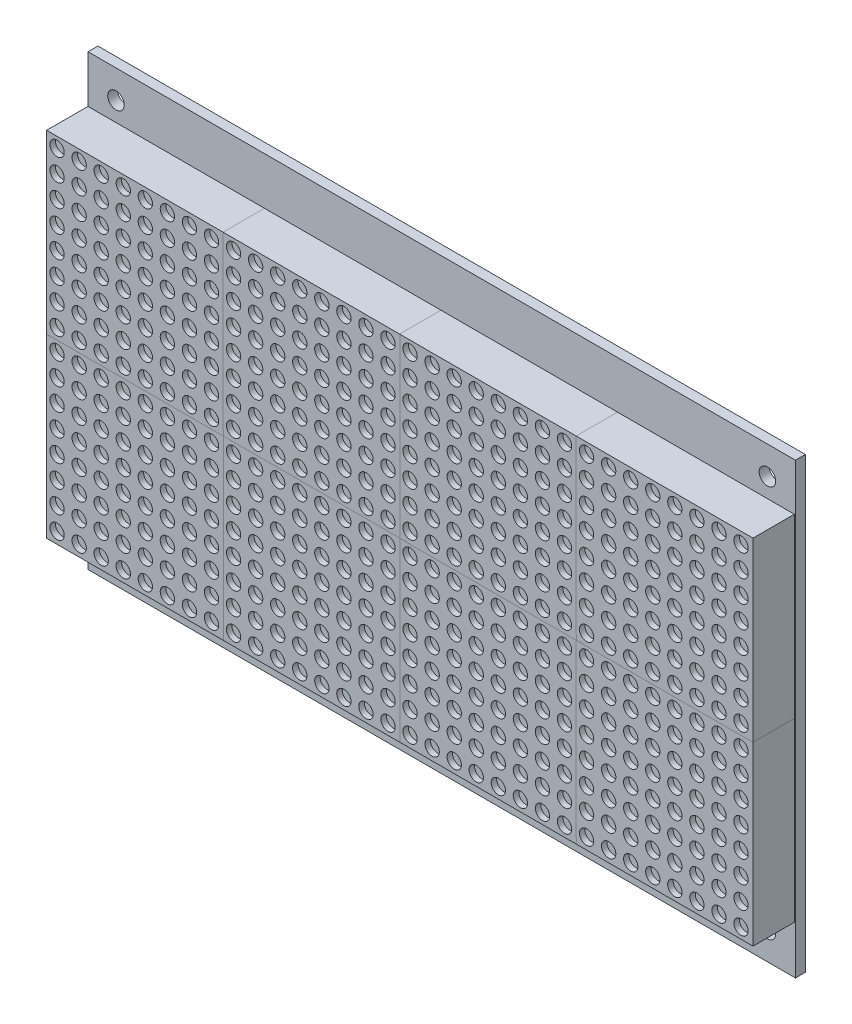
from build123d import *

# Parameters (mm, degrees)
SKETCH1_W           = 128.27
SKETCH1_H           = 81.3
SKETCH1_R           = 1.5
BOSS_EXTRUDE1_DEPTH = 1.8
SKETCH2_W           = 32.0675
SKETCH2_H           = 32.0675
BOSS_EXTRUDE2_DEPTH = 7.5
SKETCH3_R           = 1.3
CUT_EXTRUDE1_DEPTH  = 1
LPATTERN2_COUNT     = 4
LPATTERN2_PITCH     = 32
LPATTERN2_2_COUNT   = 2
LPATTERN2_2_PITCH   = 32
SKETCH4_W           = 30
SKETCH4_H           = 8.6
BOSS_EXTRUDE3_DEPTH = 17


with BuildPart() as part:
    # Sketch1 → Boss-Extrude1 (new body)
    with BuildSketch(Plane.XY):
        with Locations((64.135, 40.65)):
            Rectangle(SKETCH1_W, SKETCH1_H)
        with Locations((5.08, 76.2)):
            Circle(SKETCH1_R, mode=Mode.SUBTRACT)
        with Locations(Location((123.19, 76.2, 0), (0, 0, 180))):
            Circle(SKETCH1_R, mode=Mode.SUBTRACT)
        with Locations((123.19, 5.1)):
            Circle(SKETCH1_R, mode=Mode.SUBTRACT)
        with Locations(Location((5.08, 5.1, 0), (0, 0, 180))):
            Circle(SKETCH1_R, mode=Mode.SUBTRACT)
    extrude(amount=BOSS_EXTRUDE1_DEPTH)

    # Sketch4 → Boss-Extrude3 (add)
    with BuildSketch(Plane(origin=(0, 0, 0), x_dir=(-1, 0, 0), z_dir=(0, 0, -1))):
        with Locations((-27, 26.7)):
            Rectangle(SKETCH4_W, SKETCH4_H)
    extrude(amount=BOSS_EXTRUDE3_DEPTH)


with BuildPart() as body_2:
    # Sketch2 → Boss-Extrude2 (new body)
    with BuildSketch(Plane.XY.offset(1.8)):
        with Locations((16.03375, 56.68375)):
            Rectangle(SKETCH2_W, SKETCH2_H)
    extrude(amount=BOSS_EXTRUDE2_DEPTH)

    # Sketch3 → Cut-Extrude1 (cut)
    with BuildSketch(Plane.XY.offset(9.3)):
        with Locations((1.9, 70.8175)):
            Circle(SKETCH3_R)
        with Locations((5.9, 70.8)):
            Circle(SKETCH3_R)
        with Locations((9.9, 70.7825)):
            Circle(SKETCH3_R)
        with Locations((13.9, 70.765)):
            Circle(SKETCH3_R)
        with Locations((17.9, 70.7475)):
            Circle(SKETCH3_R)
        with Locations((21.9, 70.73)):
            Circle(SKETCH3_R)
        with Locations((25.9, 70.7125)):
            Circle(SKETCH3_R)
        with Locations((29.9, 70.695)):
            Circle(SKETCH3_R)
        with Locations((1.9, 66.8)):
            Circle(SKETCH3_R)
        with Locations((5.9, 66.7825)):
            Circle(SKETCH3_R)
        with Locations((9.9, 66.765)):
            Circle(SKETCH3_R)
        with Locations((13.9, 66.7475)):
            Circle(SKETCH3_R)
        with Locations((17.9, 66.73)):
            Circle(SKETCH3_R)
        with Locations((21.9, 66.7125)):
            Circle(SKETCH3_R)
        with Locations((25.9, 66.695)):
            Circle(SKETCH3_R)
        with Locations((29.9, 66.6775)):
            Circle(SKETCH3_R)
        with Locations((1.9, 62.7825)):
            Circle(SKETCH3_R)
        with Locations((5.9, 62.765)):
            Circle(SKETCH3_R)
        with Locations((9.9, 62.7475)):
            Circle(SKETCH3_R)
        with Locations((13.9, 62.73)):
            Circle(SKETCH3_R)
        with Locations((17.9, 62.7125)):
            Circle(SKETCH3_R)
        with Locations((21.9, 62.695)):
            Circle(SKETCH3_R)
        with Locations((25.9, 62.6775)):
            Circle(SKETCH3_R)
        with Locations((29.9, 62.66)):
            Circle(SKETCH3_R)
        with Locations((1.9, 58.765)):
            Circle(SKETCH3_R)
        with Locations((5.9, 58.7475)):
            Circle(SKETCH3_R)
        with Locations((9.9, 58.73)):
            Circle(SKETCH3_R)
        with Locations((13.9, 58.7125)):
            Circle(SKETCH3_R)
        with Locations((17.9, 58.695)):
            Circle(SKETCH3_R)
        with Locations((21.9, 58.6775)):
            Circle(SKETCH3_R)
        with Locations((25.9, 58.66)):
            Circle(SKETCH3_R)
        with Locations((29.9, 58.6425)):
            Circle(SKETCH3_R)
        with Locations((1.9, 54.7475)):
            Circle(SKETCH3_R)
        with Locations((5.9, 54.73)):
            Circle(SKETCH3_R)
        with Locations((9.9, 54.7125)):
            Circle(SKETCH3_R)
        with Locations((13.9, 54.695)):
            Circle(SKETCH3_R)
        with Locations((17.9, 54.6775)):
            Circle(SKETCH3_R)
        with Locations((21.9, 54.66)):
            Circle(SKETCH3_R)
        with Locations((25.9, 54.6425)):
            Circle(SKETCH3_R)
        with Locations((29.9, 54.625)):
            Circle(SKETCH3_R)
        with Locations((1.9, 50.73)):
            Circle(SKETCH3_R)
        with Locations((5.9, 50.7125)):
            Circle(SKETCH3_R)
        with Locations((9.9, 50.695)):
            Circle(SKETCH3_R)
        with Locations((13.9, 50.6775)):
            Circle(SKETCH3_R)
        with Locations((17.9, 50.66)):
            Circle(SKETCH3_R)
        with Locations((21.9, 50.6425)):
            Circle(SKETCH3_R)
        with Locations((25.9, 50.625)):
            Circle(SKETCH3_R)
        with Locations((29.9, 50.6075)):
            Circle(SKETCH3_R)
        with Locations((1.9, 46.7125)):
            Circle(SKETCH3_R)
        with Locations((5.9, 46.695)):
            Circle(SKETCH3_R)
        with Locations((9.9, 46.6775)):
            Circle(SKETCH3_R)
        with Locations((13.9, 46.66)):
            Circle(SKETCH3_R)
        with Locations((17.9, 46.6425)):
            Circle(SKETCH3_R)
        with Locations((21.9, 46.625)):
            Circle(SKETCH3_R)
        with Locations((25.9, 46.6075)):
            Circle(SKETCH3_R)
        with Locations((29.9, 46.59)):
            Circle(SKETCH3_R)
        with Locations((1.9, 42.695)):
            Circle(SKETCH3_R)
        with Locations((5.9, 42.6775)):
            Circle(SKETCH3_R)
        with Locations((9.9, 42.66)):
            Circle(SKETCH3_R)
        with Locations((13.9, 42.6425)):
            Circle(SKETCH3_R)
        with Locations((17.9, 42.625)):
            Circle(SKETCH3_R)
        with Locations((21.9, 42.6075)):
            Circle(SKETCH3_R)
        with Locations((25.9, 42.59)):
            Circle(SKETCH3_R)
        with Locations((29.9, 42.5725)):
            Circle(SKETCH3_R)
    extrude(amount=-CUT_EXTRUDE1_DEPTH, mode=Mode.SUBTRACT)


with BuildPart() as lpattern2_1:
    # LPattern2: pattern copy
    add(body_2.part.moved(Location(Vector(1, 0, 0) * (1 * LPATTERN2_PITCH))))


with BuildPart() as lpattern2_2:
    # LPattern2: pattern copy
    add(body_2.part.moved(Location(Vector(1, 0, 0) * (2 * LPATTERN2_PITCH))))


with BuildPart() as lpattern2_3:
    # LPattern2: pattern copy
    add(body_2.part.moved(Location(Vector(1, 0, 0) * (3 * LPATTERN2_PITCH))))


with BuildPart() as lpattern2_2_1:
    # LPattern2 2: pattern copy
    add(body_2.part.moved(Location(Vector(0, -1, 0) * (1 * LPATTERN2_2_PITCH))))


with BuildPart() as lpattern2_2_2:
    # LPattern2 2: pattern copy
    add(lpattern2_1.part.moved(Location(Vector(0, -1, 0) * (1 * LPATTERN2_2_PITCH))))


with BuildPart() as lpattern2_2_3:
    # LPattern2 2: pattern copy
    add(lpattern2_2.part.moved(Location(Vector(0, -1, 0) * (1 * LPATTERN2_2_PITCH))))


with BuildPart() as lpattern2_2_4:
    # LPattern2 2: pattern copy
    add(lpattern2_3.part.moved(Location(Vector(0, -1, 0) * (1 * LPATTERN2_2_PITCH))))


solid = Compound([part.part, body_2.part, lpattern2_1.part, lpattern2_2.part, lpattern2_3.part, lpattern2_2_1.part, lpattern2_2_2.part, lpattern2_2_3.part, lpattern2_2_4.part])
